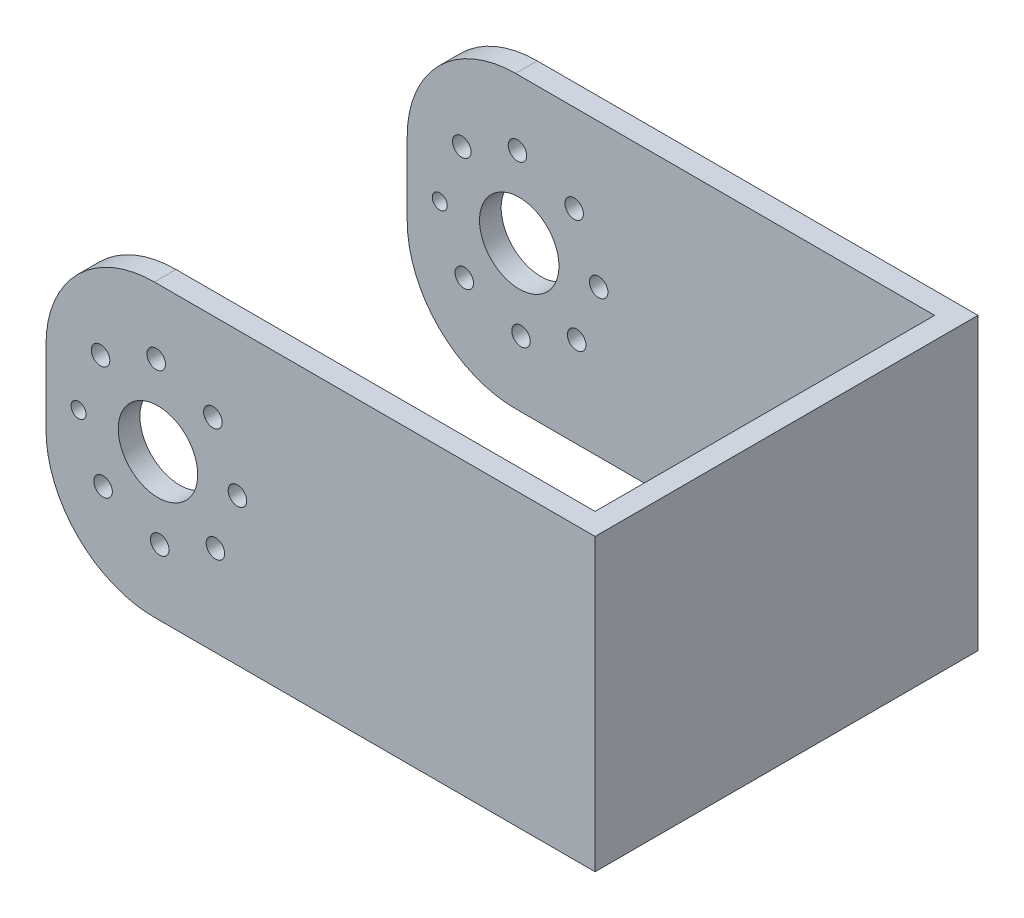
from build123d import *

# Parameters (mm, degrees)
BOSS_EXTRUDE1_DEPTH     = 40.2
CUT_EXTRUDE1_DEPTH      = 102.00019802
CUT_EXTRUDE1_DEPTH_BACK = 102.00019802
SKETCH2_R               = 5.5
FILLET1_R               = 15
CUT_EXTRUDE2_DEPTH      = 100.458735162
CUT_EXTRUDE2_DEPTH_BACK = 100.458735162
SKETCH4_R               = 1.28125
SKETCH4_R_2             = 1.035449613


with BuildPart() as part:
    # Sketch1 → Boss-Extrude1 (new body)
    with BuildSketch(Plane(origin=(0, 0, 0), x_dir=(1, 0, 0), z_dir=(0, 1, 0))):
        Polygon((0, 3), (0, 0), (76, 0), (76, 53), (0, 53), (0, 50), (73, 50), (73, 3), align=None)
    extrude(amount=BOSS_EXTRUDE1_DEPTH)

    # Sketch2 → Cut-Extrude1 (cut, two sides: drawn at the far end of the back side and taken through both)
    with BuildSketch(Plane.XY.offset(-CUT_EXTRUDE1_DEPTH_BACK)):
        with Locations((15.5, 20.1)):
            Circle(SKETCH2_R)
    extrude(amount=CUT_EXTRUDE1_DEPTH + CUT_EXTRUDE1_DEPTH_BACK, mode=Mode.SUBTRACT)

    # Fillet1
    fillet1_edges = [part.edges().sort_by_distance(p)[0] for p in [
        (0, 0, -1.5),
        (0, 40.2, -1.5),
        (0, 40.2, -51.5),
        (0, 0, -51.5),
    ]]
    fillet(fillet1_edges, radius=FILLET1_R)

    # Sketch4 → Cut-Extrude2 (cut, two sides: drawn at the far end of the back side and taken through both)
    with BuildSketch(Plane.XY.offset(-50).offset(-CUT_EXTRUDE2_DEPTH_BACK)):
        with Locations((15.746359238, 9.102759113)):
            Circle(SKETCH4_R)
        with Locations((7.897978682, 12.149574107)):
            Circle(SKETCH4_R)
        with Locations((4.502759113, 19.607840375)):
            Circle(SKETCH4_R_2)
        with Locations((7.549574107, 27.702021318)):
            Circle(SKETCH4_R)
        with Locations((23.450425893, 12.497978682)):
            Circle(SKETCH4_R)
        with Locations((15.253640762, 31.097240887)):
            Circle(SKETCH4_R)
        with Locations((23.102021318, 28.050425893)):
            Circle(SKETCH4_R)
        with Locations((26.497240887, 20.346359238)):
            Circle(SKETCH4_R)
    extrude(amount=CUT_EXTRUDE2_DEPTH + CUT_EXTRUDE2_DEPTH_BACK, mode=Mode.SUBTRACT)


solid = part.part
